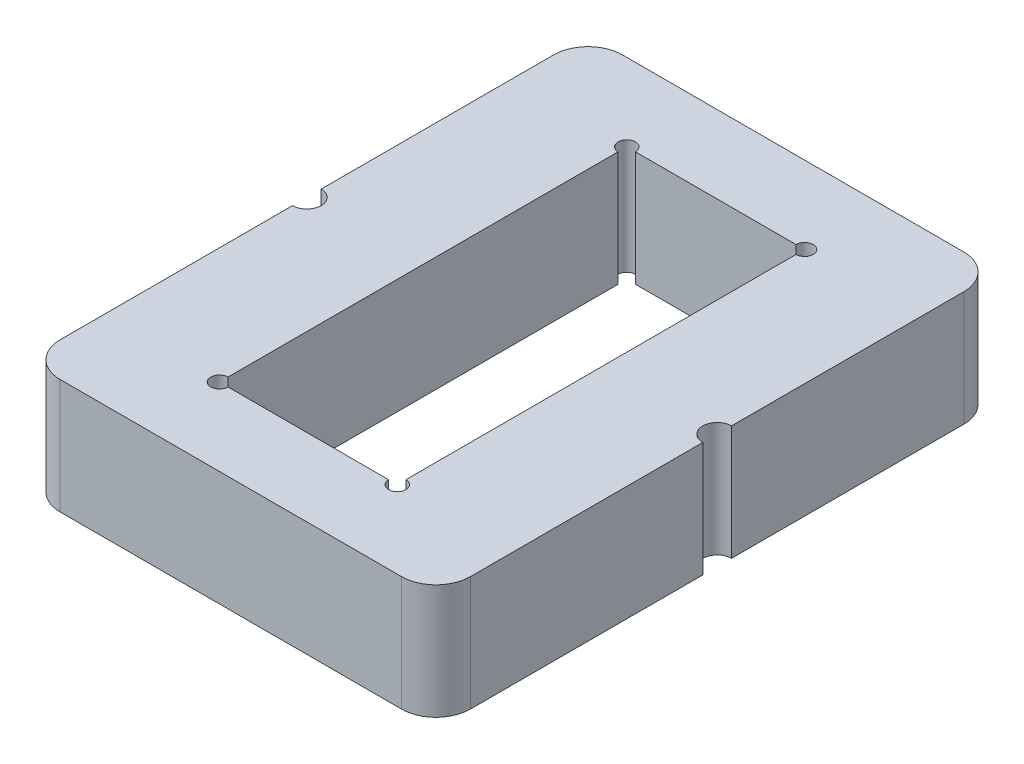
from build123d import *

# Parameters (mm, degrees)
SKETCH_1_W          = 143
SKETCH_1_H          = 196
SKETCH_1_W_2        = 62
SKETCH_1_H_2        = 142
EXTRUDE_1_DEPTH     = 20
FILLET_1_R          = 12
SKETCH_2_R          = 3
CUT_EXTRUDE_1_DEPTH = 40
SKETCH_3_R          = 5
CUT_EXTRUDE_2_DEPTH = 40


with BuildPart() as part:
    # 草图1 → 凸台-拉伸1 (new, symmetric)
    with BuildSketch(Plane(origin=(0, 0, 0), x_dir=(1, 0, 0), z_dir=(0, 1, 0))):
        Rectangle(SKETCH_1_W, SKETCH_1_H)
        Rectangle(SKETCH_1_W_2, SKETCH_1_H_2, mode=Mode.SUBTRACT)
    extrude(amount=EXTRUDE_1_DEPTH, both=True)

    # 圆角1
    fillet_1_edges = [part.edges().sort_by_distance(p)[0] for p in [
        (-71.5, 0, -98),
        (71.5, 0, -98),
        (71.5, 0, 98),
        (-71.5, 0, 98),
    ]]
    fillet(fillet_1_edges, radius=FILLET_1_R)

    # 草图2 → 切除-拉伸1 (cut)
    with BuildSketch(Plane(origin=(0, 20, 0), x_dir=(1, 0, 0), z_dir=(0, 1, 0))):
        with Locations((-31, 71)):
            Circle(SKETCH_2_R)
        with Locations((31, 71)):
            Circle(SKETCH_2_R)
        with Locations((31, -71)):
            Circle(SKETCH_2_R)
        with Locations((-31, -71)):
            Circle(SKETCH_2_R)
    extrude(amount=-CUT_EXTRUDE_1_DEPTH, mode=Mode.SUBTRACT)

    # 草图3 → 切除-拉伸2 (cut)
    with BuildSketch(Plane(origin=(0, 20, 0), x_dir=(1, 0, 0), z_dir=(0, 1, 0))):
        with Locations((-71.5, 0)):
            Circle(SKETCH_3_R)
        with Locations((71.5, 0)):
            Circle(SKETCH_3_R)
    extrude(amount=-CUT_EXTRUDE_2_DEPTH, mode=Mode.SUBTRACT)


solid = part.part
